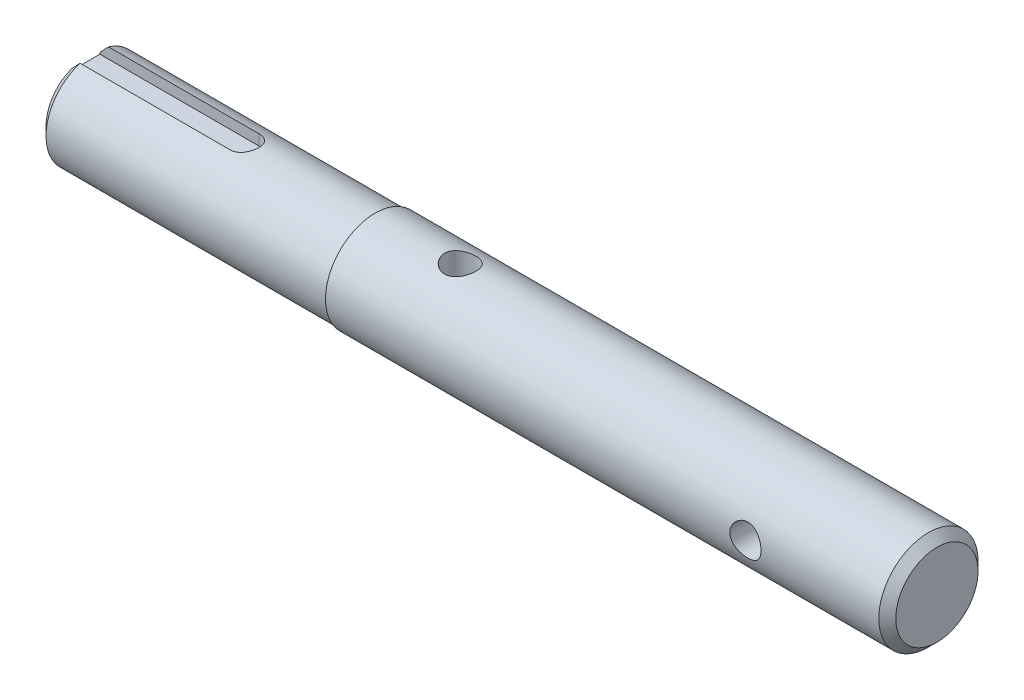
from build123d import *

# Parameters (mm, degrees)
CHAMFER1_SIZE           = 3
CUT_EXTRUDE1_START      = 17
CUT_EXTRUDE1_DEPTH      = 4.5
CUT_EXTRUDE2_DEPTH      = 302.019102384
CUT_EXTRUDE2_DEPTH_BACK = 302.019102384
SKETCH3_R               = 5.5
CUT_EXTRUDE3_DEPTH      = 302.019102396
CUT_EXTRUDE3_DEPTH_BACK = 302.019102396
SKETCH4_R               = 5.5


with BuildPart() as part:
    # Sketch1 → Revolve1 (revolve)
    with BuildSketch(Plane.XY, mode=Mode.PRIVATE) as revolve1_sk:
        Polygon((0, 0), (300, 0), (300, 17.5), (102, 17.5), (102, 17), (0, 17), align=None)
    revolve(revolve1_sk.sketch.rotate(Axis((0, 0, 0), (1, 0, 0)), 90), axis=Axis((0, 0, 0), (1, 0, 0)))

    # Chamfer1
    chamfer1_edges = [part.edges().sort_by_distance(p)[0] for p in [
        (0, 0, -17),
        (300, 0, -17.5),
    ]]
    chamfer(chamfer1_edges, length=CHAMFER1_SIZE)

    # Sketch2 → Cut-Extrude1 (cut)
    with BuildSketch(Plane(origin=(0, 0, 0), x_dir=(1, 0, 0), z_dir=(0, 1, 0)).offset(CUT_EXTRUDE1_START)):
        with BuildLine():
            Line((0, 5), (56, 5))
            ThreePointArc((56, 5), (61, 0), (56, -5))
            Line((56, -5), (0, -5))
            Line((0, -5), (0, 5))
        make_face()
    extrude(amount=-CUT_EXTRUDE1_DEPTH, mode=Mode.SUBTRACT)

    # Sketch3 → Cut-Extrude2 (cut, two sides: drawn at the far end of the back side and taken through both)
    with BuildSketch(Plane(origin=(0, 0, 0), x_dir=(1, 0, 0), z_dir=(0, 1, 0)).offset(-CUT_EXTRUDE2_DEPTH_BACK)):
        with Locations(Location((132, 0, 0), (0, 0, 270))):
            Circle(SKETCH3_R)
    extrude(amount=CUT_EXTRUDE2_DEPTH + CUT_EXTRUDE2_DEPTH_BACK, mode=Mode.SUBTRACT)

    # Sketch4 → Cut-Extrude3 (cut, two sides: drawn at the far end of the back side and taken through both)
    with BuildSketch(Plane.XY.offset(-CUT_EXTRUDE3_DEPTH_BACK)):
        with Locations((250, 0)):
            Circle(SKETCH4_R)
    extrude(amount=CUT_EXTRUDE3_DEPTH + CUT_EXTRUDE3_DEPTH_BACK, mode=Mode.SUBTRACT)


solid = part.part
